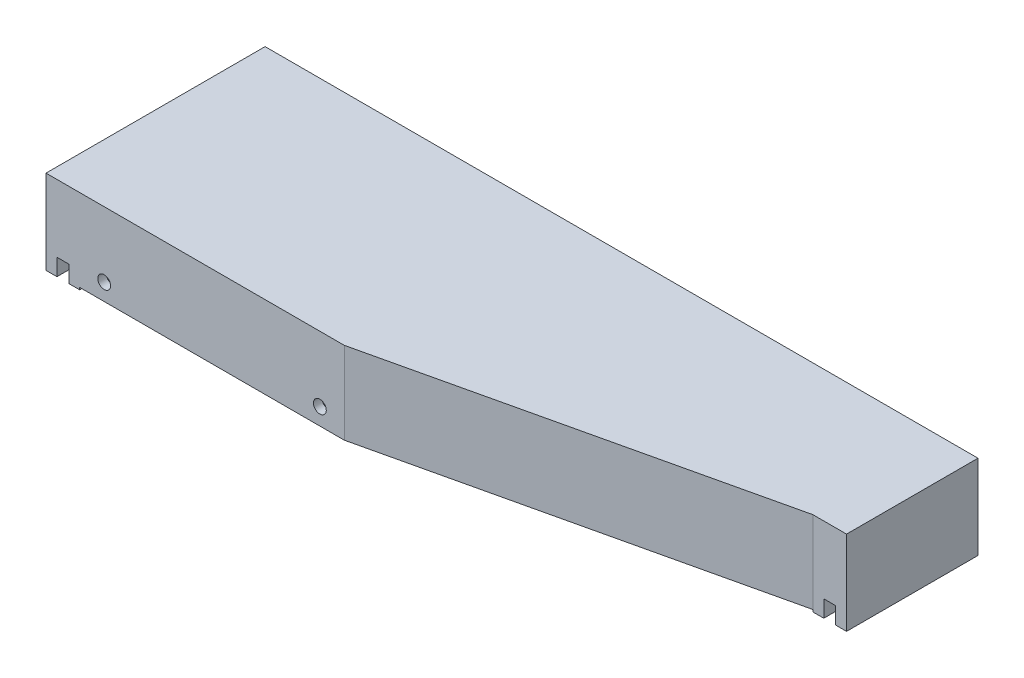
from build123d import *

# Parameters (mm, degrees)
SKETCH1_W           = 25
SKETCH1_H           = 211.5
BOSS_EXTRUDE1_DEPTH = 10
SKETCH2_W           = 10
SKETCH2_H           = 15
SKETCH2_H_2         = 10
SKETCH2_W_2         = 191.5
BOSS_EXTRUDE2_DEPTH = 45
SKETCH3_3_W         = 185
SKETCH3_3_H         = 3.5
BOSS_EXTRUDE4_DEPTH = 10
CUT_EXTRUDE11_REACH = 222.795
SKETCH15_R          = 1.9
LPATTERN2_COUNT     = 3
LPATTERN2_PITCH     = 88.5
SKETCH16_W          = 185
SKETCH16_H          = 3.5
SKETCH16_W_2        = 184.8
SKETCH16_H_2        = 3.3
CUT_EXTRUDE12_DEPTH = 10
CUT_EXTRUDE13_REACH = 222.821
SKETCH17_W          = 184.8
SKETCH17_H          = 0.2
CUT_EXTRUDE3_REACH  = 225.983
BOSS_EXTRUDE3_REACH = 224.671
CUT_EXTRUDE4_REACH  = 224.671
SKETCH10_W          = 78.5
SKETCH10_H          = 0.625
SKETCH10_W_2        = 113
SKETCH4_W           = 3.5
SKETCH4_H           = 34
CUT_EXTRUDE2_DEPTH  = 5
CUT_EXTRUDE5_DEPTH  = 5
SKETCH12_W          = 78.5
SKETCH12_H          = 5
CUT_EXTRUDE6_DEPTH  = 14.375
CUT_EXTRUDE7_REACH  = 224.671
SKETCH9_R           = 1.9
CUT_EXTRUDE9_DEPTH  = 2.5
LPATTERN1_COUNT     = 2
LPATTERN1_PITCH     = 64


with BuildPart() as part:
    # Sketch1 → Boss-Extrude1 (new body)
    with BuildSketch(Plane(origin=(0, 0, 0), x_dir=(0, 1, 0), z_dir=(0, 0, 1))):
        with Locations((12.5, 105.75)):
            Rectangle(SKETCH1_W, SKETCH1_H)
    boss_extrude1 = extrude(amount=BOSS_EXTRUDE1_DEPTH)

    # Sketch2 → Boss-Extrude2 (add)
    with BuildSketch(Plane.XY.offset(10)):
        with Locations((-5, 7.5)):
            Rectangle(SKETCH2_W, SKETCH2_H)
        with Locations((-5, 20)):
            Rectangle(SKETCH2_W, SKETCH2_H_2)
        with Locations((-105.75, 20)):
            Rectangle(SKETCH2_W_2, SKETCH2_H_2)
        with Locations((-206.5, 20)):
            Rectangle(SKETCH2_W, SKETCH2_H_2)
        with Locations((-206.5, 7.5)):
            Rectangle(SKETCH2_W, SKETCH2_H)
    extrude(amount=BOSS_EXTRUDE2_DEPTH)

    # Mirror1: Boss-Extrude1 across plane
    add(boss_extrude1.mirror(Plane.XY.offset(32.5)))

    # Sketch3<3> → Boss-Extrude4 (add)
    with BuildSketch(Plane.XZ):
        with Locations((-105.75, 5)):
            Rectangle(SKETCH3_3_W, SKETCH3_3_H)
    extrude(amount=BOSS_EXTRUDE4_DEPTH)

    # Sketch15 → Cut-Extrude11 (cut, up to next)
    with BuildSketch(Plane(origin=(0, 0, 6.75), x_dir=(-1, 0, 0), z_dir=(0, 0, 1)), mode=Mode.PRIVATE) as cut_extrude11_sk1:
        with Locations(Location((194.25, 5, 0), (0, 0, 180))):
            Circle(SKETCH15_R)
    cut_extrude11_tool1 = extrude(cut_extrude11_sk1.sketch, amount=-CUT_EXTRUDE11_REACH, mode=Mode.PRIVATE) & part.part
    cut_extrude11 = cut_extrude11_tool1.solids().sort_by_distance((-194.25, -5, 6.75))[0]
    add(cut_extrude11, mode=Mode.SUBTRACT)

    # LPattern2: Cut-Extrude11 ×3
    with Locations(*[(i * LPATTERN2_PITCH, 0, 0) for i in range(1, LPATTERN2_COUNT)]):
        add(cut_extrude11, mode=Mode.SUBTRACT)

    # Sketch16 → Cut-Extrude12 (cut)
    with BuildSketch(Plane.XZ.offset(10)):
        with Locations((-105.75, 5)):
            Rectangle(SKETCH16_W, SKETCH16_H)
        with Locations((-105.75, 5)):
            Rectangle(SKETCH16_W_2, SKETCH16_H_2, mode=Mode.SUBTRACT)
    extrude(amount=-CUT_EXTRUDE12_DEPTH, mode=Mode.SUBTRACT)

    # Sketch17 → Cut-Extrude13 (cut, up to next)
    with BuildSketch(Plane(origin=(0, 0, 6.65), x_dir=(-1, 0, 0), z_dir=(0, 0, 1)), mode=Mode.PRIVATE) as cut_extrude13_sk1:
        with Locations((105.75, 9.9)):
            Rectangle(SKETCH17_W, SKETCH17_H)
    cut_extrude13_tool1 = extrude(cut_extrude13_sk1.sketch, amount=-CUT_EXTRUDE13_REACH, mode=Mode.PRIVATE) & part.part
    add(cut_extrude13_tool1.solids().sort_by_distance((-105.75, -9.9, 6.65))[0], mode=Mode.SUBTRACT)

    # Sketch5 → Cut-Extrude3 (cut, up to next)
    with BuildSketch(Plane(origin=(0, 25, 0), x_dir=(-1, 0, 0), z_dir=(0, 1, 0)), mode=Mode.PRIVATE) as cut_extrude3_sk1:
        Polygon((0, 65), (0, 39), (10, 39), (123, 65), align=None)
    cut_extrude3_tool1 = extrude(cut_extrude3_sk1.sketch, amount=-CUT_EXTRUDE3_REACH, mode=Mode.PRIVATE) & part.part
    add(cut_extrude3_tool1.solids().sort_by_distance((-41.250627, 25, 55.681704))[0], mode=Mode.SUBTRACT)

    # Sketch7 → Boss-Extrude3 (add, up to next)
    with BuildSketch(Plane.XZ, mode=Mode.PRIVATE) as boss_extrude3_sk1:
        Polygon((-10, 39), (-123, 65), (-123, 55), (-10, 29), align=None)
    boss_extrude3_tool1 = extrude(boss_extrude3_sk1.sketch, amount=-BOSS_EXTRUDE3_REACH, mode=Mode.PRIVATE) - part.part
    add(boss_extrude3_tool1.solids().sort_by_distance((-66.5, 0, 47))[0])

    # Sketch10 → Cut-Extrude4 (cut, up to next)
    with BuildSketch(Plane.XY.offset(65), mode=Mode.PRIVATE) as cut_extrude4_sk1:
        with Locations((-162.25, 0.3125)):
            Rectangle(SKETCH10_W, SKETCH10_H)
    cut_extrude4_tool1 = extrude(cut_extrude4_sk1.sketch, amount=-CUT_EXTRUDE4_REACH, mode=Mode.PRIVATE) & part.part
    # Sketch10 → Cut-Extrude4 (cut, up to next)
    with BuildSketch(Plane.XY.offset(65), mode=Mode.PRIVATE) as cut_extrude4_sk2:
        with Locations((-66.5, 0.3125)):
            Rectangle(SKETCH10_W_2, SKETCH10_H)
    cut_extrude4_tool2 = extrude(cut_extrude4_sk2.sketch, amount=-CUT_EXTRUDE4_REACH, mode=Mode.PRIVATE) & part.part
    add(cut_extrude4_tool1.solids().sort_by_distance((-162.25, 0.3125, 65))[0], mode=Mode.SUBTRACT)
    add(cut_extrude4_tool2.solids().sort_by_distance((-66.5, 0.3125, 65))[0], mode=Mode.SUBTRACT)

    # Sketch4 → Cut-Extrude2 (cut)
    with BuildSketch(Plane.XZ):
        with Locations((-5, 22)):
            Rectangle(SKETCH4_W, SKETCH4_H)
    extrude(amount=-CUT_EXTRUDE2_DEPTH, mode=Mode.SUBTRACT)

    # Sketch11 → Cut-Extrude5 (cut)
    with BuildSketch(Plane.XZ):
        Polygon((-208.25, 15), (-208.25, 5), (-204.75, 5), (-204.75, 15), (-204.75, 65), (-208.25, 65), align=None)
    extrude(amount=-CUT_EXTRUDE5_DEPTH, mode=Mode.SUBTRACT)

    # Sketch12 → Cut-Extrude6 (cut)
    with BuildSketch(Plane.XZ.offset(-0.625)):
        with Locations((-162.25, 57.5)):
            Rectangle(SKETCH12_W, SKETCH12_H)
    extrude(amount=-CUT_EXTRUDE6_DEPTH, mode=Mode.SUBTRACT)

    # Sketch9 → Cut-Extrude7 (cut, up to next)
    with BuildSketch(Plane.XY.offset(65), mode=Mode.PRIVATE) as cut_extrude7_sk1:
        with Locations((-194.25, 5.625)):
            Circle(SKETCH9_R)
    cut_extrude7_tool1 = extrude(cut_extrude7_sk1.sketch, amount=-CUT_EXTRUDE7_REACH, mode=Mode.PRIVATE) & part.part
    cut_extrude7 = cut_extrude7_tool1.solids().sort_by_distance((-194.25, 5.625, 65))[0]
    add(cut_extrude7, mode=Mode.SUBTRACT)

    # Sketch13 → Cut-Extrude9 (cut)
    with BuildSketch(Plane(origin=(0, 0, 60), x_dir=(1, 0, 0), z_dir=(0, 0, -1))):
        Polygon((-192.297927406, -9.006088913), (-190.345854812, -5.625), (-192.297927406, -2.243911087), (-196.202072594, -2.243911087), (-198.154145188, -5.625), (-196.202072594, -9.006088913), align=None)
    cut_extrude9 = extrude(amount=-CUT_EXTRUDE9_DEPTH, mode=Mode.SUBTRACT)

    # LPattern1: Cut-Extrude7, Cut-Extrude9 ×2
    with Locations(*[(i * LPATTERN1_PITCH, 0, 0) for i in range(1, LPATTERN1_COUNT)]):
        add(cut_extrude7, mode=Mode.SUBTRACT)
        add(cut_extrude9, mode=Mode.SUBTRACT)


solid = part.part
